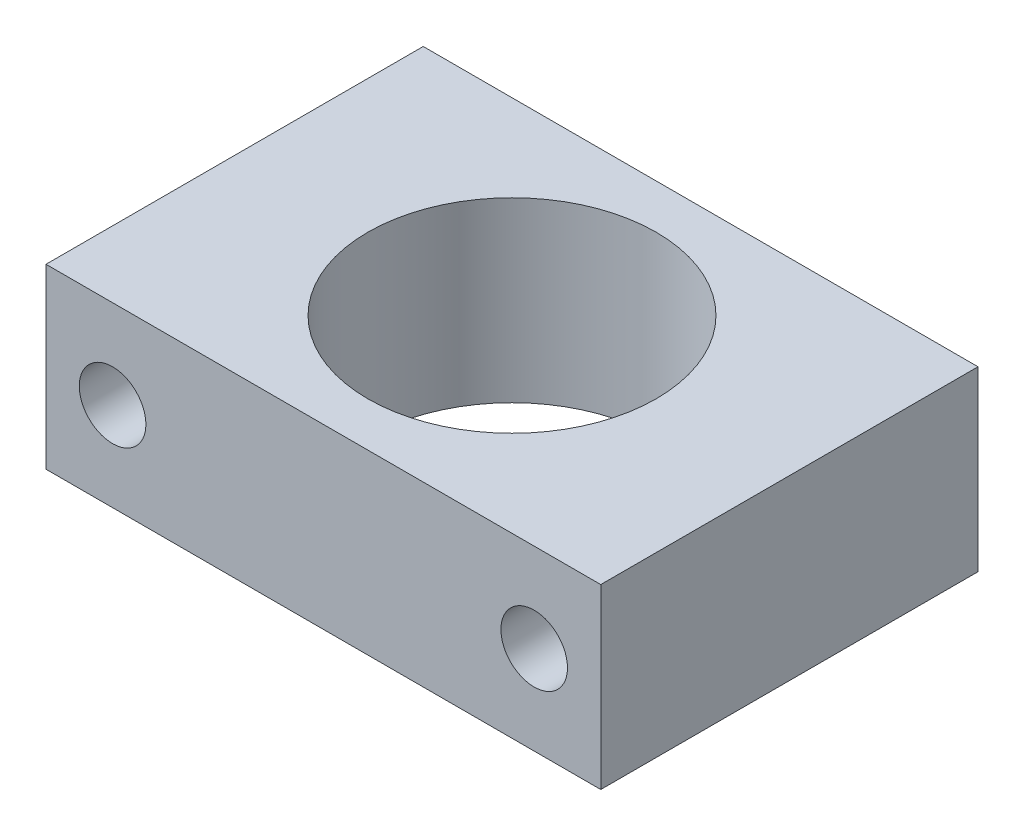
from build123d import *

# Parameters (mm, degrees)
SKETCH_1_W          = 25
SKETCH_1_H          = 17
SKETCH_1_R          = 6.5
EXTRUDE_1_DEPTH     = 4
SKETCH_2_R          = 1.5
CUT_EXTRUDE_1_DEPTH = 22.476731595


with BuildPart() as part:
    # 草图1 → 凸台-拉伸1 (new, symmetric)
    with BuildSketch(Plane(origin=(0, 0, 0), x_dir=(1, 0, 0), z_dir=(0, 1, 0))):
        Rectangle(SKETCH_1_W, SKETCH_1_H)
        with Locations(Location((0, 0, 0), (0, 0, 270))):
            Circle(SKETCH_1_R, mode=Mode.SUBTRACT)
    extrude(amount=EXTRUDE_1_DEPTH, both=True)

    # 草图2 → 切除-拉伸1 (cut, through all)
    with BuildSketch(Plane(origin=(0, 0, -8.5), x_dir=(-1, 0, 0), z_dir=(0, 0, -1))):
        with Locations((9.5, 0)):
            Circle(SKETCH_2_R)
        with Locations(Location((-9.5, 0, 0), (0, 0, 180))):
            Circle(SKETCH_2_R)
    extrude(amount=-CUT_EXTRUDE_1_DEPTH, mode=Mode.SUBTRACT)


solid = part.part
